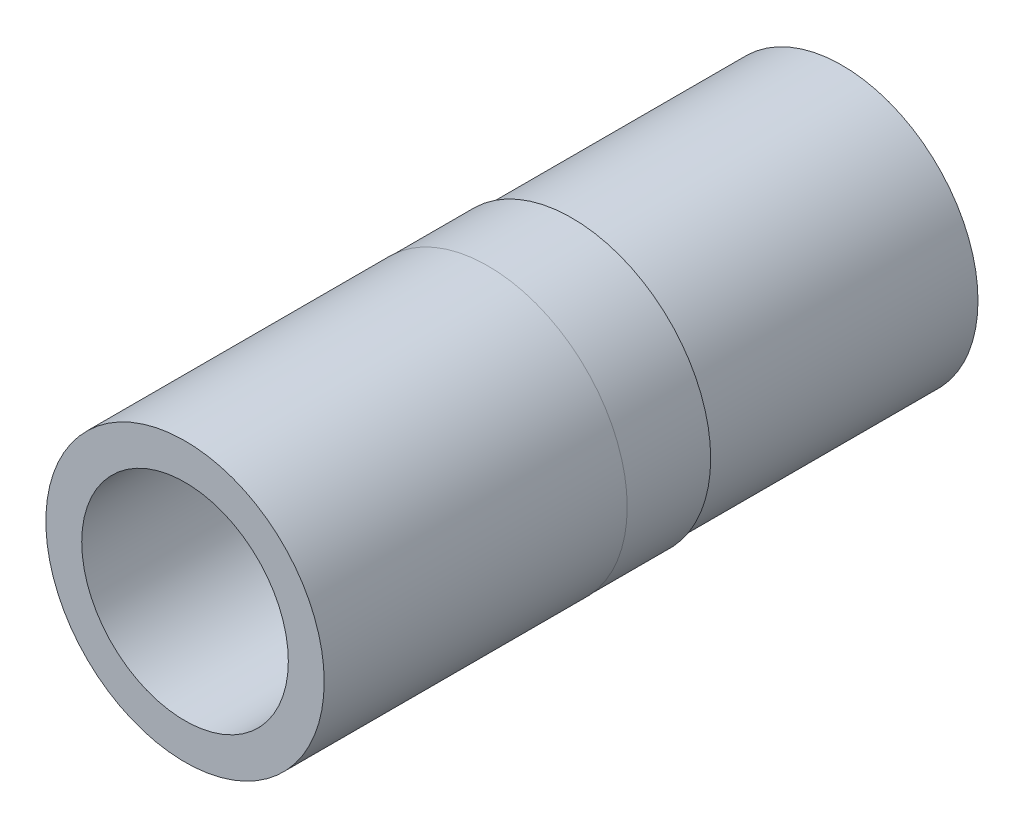
from build123d import *

# Parameters (mm, degrees)
SKETCH1_R               = 25.795
SKETCH1_R_2             = 18.885
BOSS_EXTRUDE1_DEPTH     = 67.2
SKETCH2_R               = 21.795
SKETCH2_R_2             = 21.195
CUT_EXTRUDE2_DEPTH      = 10.73
CUT_EXTRUDE3_DEPTH      = 77.463089462
CUT_EXTRUDE3_DEPTH_BACK = 77.463089462
SKETCH3_R               = 21.195
SKETCH3_R_2             = 18.885
SKETCH4_R               = 26.36
BOSS_EXTRUDE2_DEPTH     = 15.9
SKETCH5_R               = 26.415
BOSS_EXTRUDE3_DEPTH     = 57.51
CUT_EXTRUDE6_DEPTH      = 83.368273929
CUT_EXTRUDE6_DEPTH_BACK = 83.368273929
SKETCH10_R              = 19.607658562


with BuildPart() as part:
    # Sketch1 → Boss-Extrude1 (new body)
    with BuildSketch(Plane.XY):
        Circle(SKETCH1_R)
        Circle(SKETCH1_R_2, mode=Mode.SUBTRACT)
    extrude(amount=BOSS_EXTRUDE1_DEPTH)

    # Sketch2 → Cut-Extrude2 (cut)
    with BuildSketch(Plane(origin=(0, 0, 0), x_dir=(-1, 0, 0), z_dir=(0, 0, -1))):
        Circle(SKETCH2_R)
        Circle(SKETCH2_R_2, mode=Mode.SUBTRACT)
    extrude(amount=-CUT_EXTRUDE2_DEPTH, mode=Mode.SUBTRACT)

    # Sketch3 → Cut-Extrude3 (cut, two sides: drawn at the far end of the back side and taken through both)
    with BuildSketch(Plane(origin=(0, 0, 0), x_dir=(-1, 0, 0), z_dir=(0, 0, -1)).offset(-CUT_EXTRUDE3_DEPTH_BACK)):
        Circle(SKETCH3_R)
        Circle(SKETCH3_R_2, mode=Mode.SUBTRACT)
    extrude(amount=CUT_EXTRUDE3_DEPTH + CUT_EXTRUDE3_DEPTH_BACK, mode=Mode.SUBTRACT)

    # Sketch4 → Boss-Extrude2 (add)
    with BuildSketch(Plane.XY.offset(67.2)):
        Circle(SKETCH4_R)
    extrude(amount=-BOSS_EXTRUDE2_DEPTH)

    # Sketch5 → Boss-Extrude3 (add)
    with BuildSketch(Plane.XY.offset(67.2)):
        Circle(SKETCH5_R)
    extrude(amount=BOSS_EXTRUDE3_DEPTH)

    # Sketch10 → Cut-Extrude6 (cut, two sides: drawn at the far end of the back side and taken through both)
    with BuildSketch(Plane(origin=(0, 0, 51.3), x_dir=(-1, 0, 0), z_dir=(0, 0, -1)).offset(-CUT_EXTRUDE6_DEPTH_BACK)):
        Circle(SKETCH10_R)
    extrude(amount=CUT_EXTRUDE6_DEPTH + CUT_EXTRUDE6_DEPTH_BACK, mode=Mode.SUBTRACT)


solid = part.part
